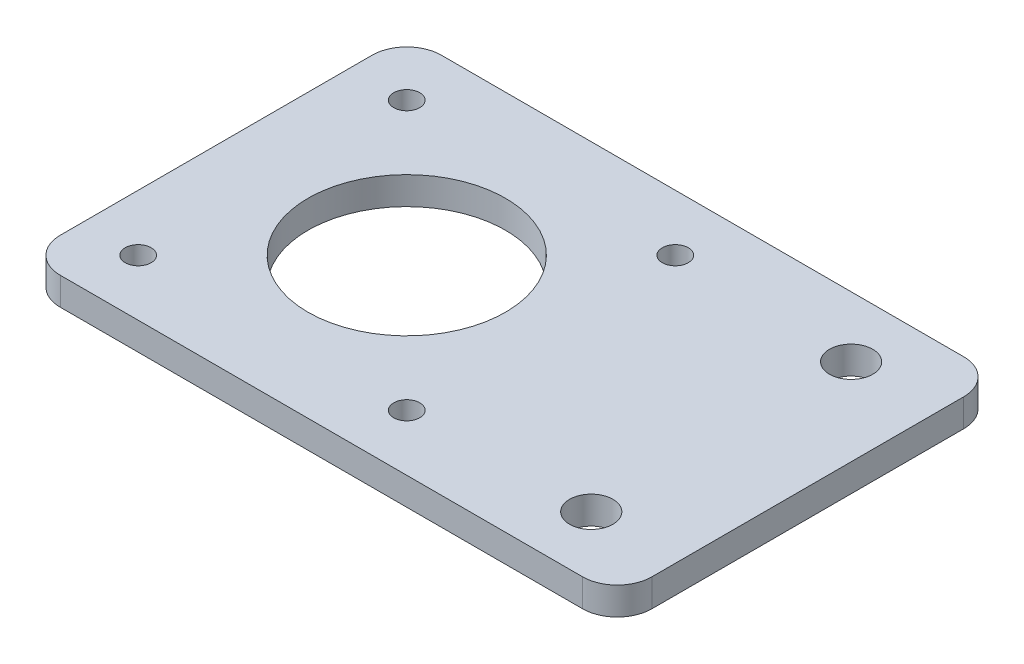
from build123d import *

# Parameters (mm, degrees)
SKETCH1_W           = 68.3
SKETCH1_H           = 44
BOSS_EXTRUDE1_DEPTH = 3.2
SKETCH2_R           = 11.4
SKETCH2_R_2         = 2.5
SKETCH2_R_3         = 1.5
CUT_EXTRUDE2_DEPTH  = 41.748772988
FILLET1_R           = 4


with BuildPart() as part:
    # Sketch1 → Boss-Extrude1 (new body)
    with BuildSketch(Plane(origin=(0, 0, 0), x_dir=(1, 0, 0), z_dir=(0, 1, 0))):
        Rectangle(SKETCH1_W, SKETCH1_H)
    extrude(amount=BOSS_EXTRUDE1_DEPTH)

    # Sketch2 → Cut-Extrude2 (cut, through all)
    with BuildSketch(Plane(origin=(0, 3.2, 0), x_dir=(1, 0, 0), z_dir=(0, 1, 0))):
        with Locations(Location((-12.15, 0, 0), (0, 0, 270))):
            Circle(SKETCH2_R)
        with Locations(Location((24.15, 15, 0), (0, 0, 270))):
            Circle(SKETCH2_R_2)
        with Locations(Location((24.15, -15, 0), (0, 0, 270))):
            Circle(SKETCH2_R_2)
        with Locations(Location((-27.65, 15.5, 0), (0, 0, 270))):
            Circle(SKETCH2_R_3)
        with Locations(Location((3.35, 15.5, 0), (0, 0, 270))):
            Circle(SKETCH2_R_3)
        with Locations(Location((3.35, -15.5, 0), (0, 0, 270))):
            Circle(SKETCH2_R_3)
        with Locations(Location((-27.65, -15.5, 0), (0, 0, 270))):
            Circle(SKETCH2_R_3)
    extrude(amount=-CUT_EXTRUDE2_DEPTH, mode=Mode.SUBTRACT)

    # Fillet1
    fillet1_edges = [part.edges().sort_by_distance(p)[0] for p in [
        (34.15, 1.6, 22),
        (-34.15, 1.6, 22),
        (-34.15, 1.6, -22),
        (34.15, 1.6, -22),
    ]]
    fillet(fillet1_edges, radius=FILLET1_R)


solid = part.part
